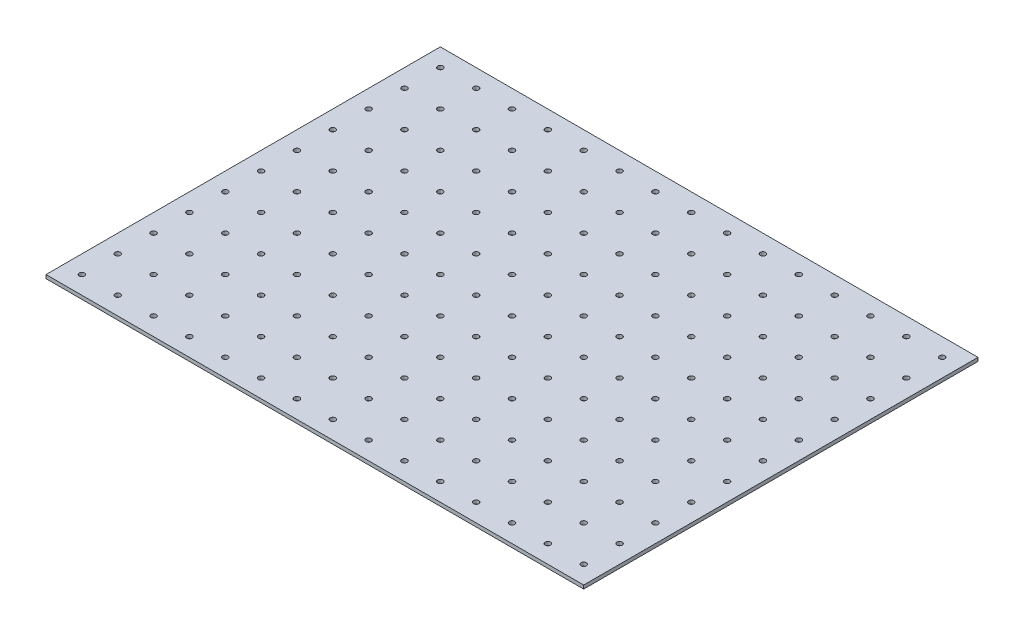
from build123d import *

# Parameters (mm, degrees)
SKETCH1_W           = 300
SKETCH1_H           = 220
BOSS_EXTRUDE1_DEPTH = 1
SKETCH3_R           = 1.5
CUT_EXTRUDE1_DEPTH  = 187.021504133


with BuildPart() as part:
    # Sketch1 → Boss-Extrude1 (new, symmetric)
    with BuildSketch(Plane(origin=(0, 0, 0), x_dir=(1, 0, 0), z_dir=(0, 1, 0))):
        Rectangle(SKETCH1_W, SKETCH1_H)
    extrude(amount=BOSS_EXTRUDE1_DEPTH, both=True)

    # Sketch3 → Cut-Extrude1 (cut, through all)
    with BuildSketch(Plane(origin=(0, 1, 0), x_dir=(1, 0, 0), z_dir=(0, 1, 0))):
        with Locations(Location((-140, 100, 0), (0, 0, 270))):
            Circle(SKETCH3_R)
        with Locations(Location((-120, 100, 0), (0, 0, 270))):
            Circle(SKETCH3_R)
        with Locations(Location((-100, 100, 0), (0, 0, 270))):
            Circle(SKETCH3_R)
        with Locations(Location((-80, 100, 0), (0, 0, 270))):
            Circle(SKETCH3_R)
        with Locations(Location((-60, 100, 0), (0, 0, 270))):
            Circle(SKETCH3_R)
        with Locations(Location((-40, 100, 0), (0, 0, 270))):
            Circle(SKETCH3_R)
        with Locations(Location((-20, 100, 0), (0, 0, 270))):
            Circle(SKETCH3_R)
        with Locations(Location((0, 100, 0), (0, 0, 270))):
            Circle(SKETCH3_R)
        with Locations(Location((20, 100, 0), (0, 0, 270))):
            Circle(SKETCH3_R)
        with Locations(Location((40, 100, 0), (0, 0, 270))):
            Circle(SKETCH3_R)
        with Locations(Location((60, 100, 0), (0, 0, 270))):
            Circle(SKETCH3_R)
        with Locations(Location((80, 100, 0), (0, 0, 270))):
            Circle(SKETCH3_R)
        with Locations(Location((100, 100, 0), (0, 0, 270))):
            Circle(SKETCH3_R)
        with Locations(Location((120, 100, 0), (0, 0, 270))):
            Circle(SKETCH3_R)
        with Locations(Location((140, 100, 0), (0, 0, 270))):
            Circle(SKETCH3_R)
        with Locations(Location((-120, 80, 0), (0, 0, 270))):
            Circle(SKETCH3_R)
        with Locations(Location((-100, 80, 0), (0, 0, 270))):
            Circle(SKETCH3_R)
        with Locations(Location((-80, 80, 0), (0, 0, 270))):
            Circle(SKETCH3_R)
        with Locations(Location((-60, 80, 0), (0, 0, 270))):
            Circle(SKETCH3_R)
        with Locations(Location((-40, 80, 0), (0, 0, 270))):
            Circle(SKETCH3_R)
        with Locations(Location((-20, 80, 0), (0, 0, 270))):
            Circle(SKETCH3_R)
        with Locations(Location((0, 80, 0), (0, 0, 270))):
            Circle(SKETCH3_R)
        with Locations(Location((20, 80, 0), (0, 0, 270))):
            Circle(SKETCH3_R)
        with Locations(Location((40, 80, 0), (0, 0, 270))):
            Circle(SKETCH3_R)
        with Locations(Location((60, 80, 0), (0, 0, 270))):
            Circle(SKETCH3_R)
        with Locations(Location((80, 80, 0), (0, 0, 270))):
            Circle(SKETCH3_R)
        with Locations(Location((100, 80, 0), (0, 0, 270))):
            Circle(SKETCH3_R)
        with Locations(Location((120, 80, 0), (0, 0, 270))):
            Circle(SKETCH3_R)
        with Locations(Location((140, 80, 0), (0, 0, 270))):
            Circle(SKETCH3_R)
        with Locations(Location((-120, 60, 0), (0, 0, 270))):
            Circle(SKETCH3_R)
        with Locations(Location((-100, 60, 0), (0, 0, 270))):
            Circle(SKETCH3_R)
        with Locations(Location((-80, 60, 0), (0, 0, 270))):
            Circle(SKETCH3_R)
        with Locations(Location((-60, 60, 0), (0, 0, 270))):
            Circle(SKETCH3_R)
        with Locations(Location((-40, 60, 0), (0, 0, 270))):
            Circle(SKETCH3_R)
        with Locations(Location((-20, 60, 0), (0, 0, 270))):
            Circle(SKETCH3_R)
        with Locations(Location((0, 60, 0), (0, 0, 270))):
            Circle(SKETCH3_R)
        with Locations(Location((20, 60, 0), (0, 0, 270))):
            Circle(SKETCH3_R)
        with Locations(Location((40, 60, 0), (0, 0, 270))):
            Circle(SKETCH3_R)
        with Locations(Location((60, 60, 0), (0, 0, 270))):
            Circle(SKETCH3_R)
        with Locations(Location((80, 60, 0), (0, 0, 270))):
            Circle(SKETCH3_R)
        with Locations(Location((100, 60, 0), (0, 0, 270))):
            Circle(SKETCH3_R)
        with Locations(Location((120, 60, 0), (0, 0, 270))):
            Circle(SKETCH3_R)
        with Locations(Location((140, 60, 0), (0, 0, 270))):
            Circle(SKETCH3_R)
        with Locations(Location((-120, 40, 0), (0, 0, 270))):
            Circle(SKETCH3_R)
        with Locations(Location((-100, 40, 0), (0, 0, 270))):
            Circle(SKETCH3_R)
        with Locations(Location((-80, 40, 0), (0, 0, 270))):
            Circle(SKETCH3_R)
        with Locations(Location((-60, 40, 0), (0, 0, 270))):
            Circle(SKETCH3_R)
        with Locations(Location((-40, 40, 0), (0, 0, 270))):
            Circle(SKETCH3_R)
        with Locations(Location((-20, 40, 0), (0, 0, 270))):
            Circle(SKETCH3_R)
        with Locations(Location((0, 40, 0), (0, 0, 270))):
            Circle(SKETCH3_R)
        with Locations(Location((20, 40, 0), (0, 0, 270))):
            Circle(SKETCH3_R)
        with Locations(Location((40, 40, 0), (0, 0, 270))):
            Circle(SKETCH3_R)
        with Locations(Location((60, 40, 0), (0, 0, 270))):
            Circle(SKETCH3_R)
        with Locations(Location((80, 40, 0), (0, 0, 270))):
            Circle(SKETCH3_R)
        with Locations(Location((100, 40, 0), (0, 0, 270))):
            Circle(SKETCH3_R)
        with Locations(Location((120, 40, 0), (0, 0, 270))):
            Circle(SKETCH3_R)
        with Locations(Location((140, 40, 0), (0, 0, 270))):
            Circle(SKETCH3_R)
        with Locations(Location((-120, 20, 0), (0, 0, 270))):
            Circle(SKETCH3_R)
        with Locations(Location((-100, 20, 0), (0, 0, 270))):
            Circle(SKETCH3_R)
        with Locations(Location((-80, 20, 0), (0, 0, 270))):
            Circle(SKETCH3_R)
        with Locations(Location((-60, 20, 0), (0, 0, 270))):
            Circle(SKETCH3_R)
        with Locations(Location((-40, 20, 0), (0, 0, 270))):
            Circle(SKETCH3_R)
        with Locations(Location((-20, 20, 0), (0, 0, 270))):
            Circle(SKETCH3_R)
        with Locations(Location((0, 20, 0), (0, 0, 270))):
            Circle(SKETCH3_R)
        with Locations(Location((20, 20, 0), (0, 0, 270))):
            Circle(SKETCH3_R)
        with Locations(Location((40, 20, 0), (0, 0, 270))):
            Circle(SKETCH3_R)
        with Locations(Location((60, 20, 0), (0, 0, 270))):
            Circle(SKETCH3_R)
        with Locations(Location((80, 20, 0), (0, 0, 270))):
            Circle(SKETCH3_R)
        with Locations(Location((100, 20, 0), (0, 0, 270))):
            Circle(SKETCH3_R)
        with Locations(Location((120, 20, 0), (0, 0, 270))):
            Circle(SKETCH3_R)
        with Locations(Location((140, 20, 0), (0, 0, 270))):
            Circle(SKETCH3_R)
        with Locations(Location((-120, 0, 0), (0, 0, 270))):
            Circle(SKETCH3_R)
        with Locations(Location((-100, 0, 0), (0, 0, 270))):
            Circle(SKETCH3_R)
        with Locations(Location((-80, 0, 0), (0, 0, 270))):
            Circle(SKETCH3_R)
        with Locations(Location((-60, 0, 0), (0, 0, 270))):
            Circle(SKETCH3_R)
        with Locations(Location((-40, 0, 0), (0, 0, 270))):
            Circle(SKETCH3_R)
        with Locations(Location((-20, 0, 0), (0, 0, 270))):
            Circle(SKETCH3_R)
        with Locations(Location((0, 0, 0), (0, 0, 270))):
            Circle(SKETCH3_R)
        with Locations(Location((20, 0, 0), (0, 0, 270))):
            Circle(SKETCH3_R)
        with Locations(Location((40, 0, 0), (0, 0, 270))):
            Circle(SKETCH3_R)
        with Locations(Location((60, 0, 0), (0, 0, 270))):
            Circle(SKETCH3_R)
        with Locations(Location((80, 0, 0), (0, 0, 270))):
            Circle(SKETCH3_R)
        with Locations(Location((100, 0, 0), (0, 0, 270))):
            Circle(SKETCH3_R)
        with Locations(Location((120, 0, 0), (0, 0, 270))):
            Circle(SKETCH3_R)
        with Locations(Location((140, 0, 0), (0, 0, 270))):
            Circle(SKETCH3_R)
        with Locations(Location((-120, -20, 0), (0, 0, 270))):
            Circle(SKETCH3_R)
        with Locations(Location((-100, -20, 0), (0, 0, 270))):
            Circle(SKETCH3_R)
        with Locations(Location((-80, -20, 0), (0, 0, 270))):
            Circle(SKETCH3_R)
        with Locations(Location((-60, -20, 0), (0, 0, 270))):
            Circle(SKETCH3_R)
        with Locations(Location((-40, -20, 0), (0, 0, 270))):
            Circle(SKETCH3_R)
        with Locations(Location((-20, -20, 0), (0, 0, 270))):
            Circle(SKETCH3_R)
        with Locations(Location((0, -20, 0), (0, 0, 270))):
            Circle(SKETCH3_R)
        with Locations(Location((20, -20, 0), (0, 0, 270))):
            Circle(SKETCH3_R)
        with Locations(Location((40, -20, 0), (0, 0, 270))):
            Circle(SKETCH3_R)
        with Locations(Location((60, -20, 0), (0, 0, 270))):
            Circle(SKETCH3_R)
        with Locations(Location((80, -20, 0), (0, 0, 270))):
            Circle(SKETCH3_R)
        with Locations(Location((100, -20, 0), (0, 0, 270))):
            Circle(SKETCH3_R)
        with Locations(Location((120, -20, 0), (0, 0, 270))):
            Circle(SKETCH3_R)
        with Locations(Location((140, -20, 0), (0, 0, 270))):
            Circle(SKETCH3_R)
        with Locations(Location((-120, -40, 0), (0, 0, 270))):
            Circle(SKETCH3_R)
        with Locations(Location((-100, -40, 0), (0, 0, 270))):
            Circle(SKETCH3_R)
        with Locations(Location((-80, -40, 0), (0, 0, 270))):
            Circle(SKETCH3_R)
        with Locations(Location((-60, -40, 0), (0, 0, 270))):
            Circle(SKETCH3_R)
        with Locations(Location((-40, -40, 0), (0, 0, 270))):
            Circle(SKETCH3_R)
        with Locations(Location((-20, -40, 0), (0, 0, 270))):
            Circle(SKETCH3_R)
        with Locations(Location((0, -40, 0), (0, 0, 270))):
            Circle(SKETCH3_R)
        with Locations(Location((20, -40, 0), (0, 0, 270))):
            Circle(SKETCH3_R)
        with Locations(Location((40, -40, 0), (0, 0, 270))):
            Circle(SKETCH3_R)
        with Locations(Location((60, -40, 0), (0, 0, 270))):
            Circle(SKETCH3_R)
        with Locations(Location((80, -40, 0), (0, 0, 270))):
            Circle(SKETCH3_R)
        with Locations(Location((100, -40, 0), (0, 0, 270))):
            Circle(SKETCH3_R)
        with Locations(Location((120, -40, 0), (0, 0, 270))):
            Circle(SKETCH3_R)
        with Locations(Location((140, -40, 0), (0, 0, 270))):
            Circle(SKETCH3_R)
        with Locations(Location((-120, -60, 0), (0, 0, 270))):
            Circle(SKETCH3_R)
        with Locations(Location((-100, -60, 0), (0, 0, 270))):
            Circle(SKETCH3_R)
        with Locations(Location((-80, -60, 0), (0, 0, 270))):
            Circle(SKETCH3_R)
        with Locations(Location((-60, -60, 0), (0, 0, 270))):
            Circle(SKETCH3_R)
        with Locations(Location((-40, -60, 0), (0, 0, 270))):
            Circle(SKETCH3_R)
        with Locations(Location((-20, -60, 0), (0, 0, 270))):
            Circle(SKETCH3_R)
        with Locations(Location((0, -60, 0), (0, 0, 270))):
            Circle(SKETCH3_R)
        with Locations(Location((20, -60, 0), (0, 0, 270))):
            Circle(SKETCH3_R)
        with Locations(Location((40, -60, 0), (0, 0, 270))):
            Circle(SKETCH3_R)
        with Locations(Location((60, -60, 0), (0, 0, 270))):
            Circle(SKETCH3_R)
        with Locations(Location((80, -60, 0), (0, 0, 270))):
            Circle(SKETCH3_R)
        with Locations(Location((100, -60, 0), (0, 0, 270))):
            Circle(SKETCH3_R)
        with Locations(Location((120, -60, 0), (0, 0, 270))):
            Circle(SKETCH3_R)
        with Locations(Location((140, -60, 0), (0, 0, 270))):
            Circle(SKETCH3_R)
        with Locations(Location((-120, -80, 0), (0, 0, 270))):
            Circle(SKETCH3_R)
        with Locations(Location((-100, -80, 0), (0, 0, 270))):
            Circle(SKETCH3_R)
        with Locations(Location((-80, -80, 0), (0, 0, 270))):
            Circle(SKETCH3_R)
        with Locations(Location((-60, -80, 0), (0, 0, 270))):
            Circle(SKETCH3_R)
        with Locations(Location((-40, -80, 0), (0, 0, 270))):
            Circle(SKETCH3_R)
        with Locations(Location((-20, -80, 0), (0, 0, 270))):
            Circle(SKETCH3_R)
        with Locations(Location((0, -80, 0), (0, 0, 270))):
            Circle(SKETCH3_R)
        with Locations(Location((20, -80, 0), (0, 0, 270))):
            Circle(SKETCH3_R)
        with Locations(Location((40, -80, 0), (0, 0, 270))):
            Circle(SKETCH3_R)
        with Locations(Location((60, -80, 0), (0, 0, 270))):
            Circle(SKETCH3_R)
        with Locations(Location((80, -80, 0), (0, 0, 270))):
            Circle(SKETCH3_R)
        with Locations(Location((100, -80, 0), (0, 0, 270))):
            Circle(SKETCH3_R)
        with Locations(Location((120, -80, 0), (0, 0, 270))):
            Circle(SKETCH3_R)
        with Locations(Location((140, -80, 0), (0, 0, 270))):
            Circle(SKETCH3_R)
        with Locations(Location((-120, -100, 0), (0, 0, 270))):
            Circle(SKETCH3_R)
        with Locations(Location((-100, -100, 0), (0, 0, 270))):
            Circle(SKETCH3_R)
        with Locations(Location((-80, -100, 0), (0, 0, 270))):
            Circle(SKETCH3_R)
        with Locations(Location((-60, -100, 0), (0, 0, 270))):
            Circle(SKETCH3_R)
        with Locations(Location((-40, -100, 0), (0, 0, 270))):
            Circle(SKETCH3_R)
        with Locations(Location((-20, -100, 0), (0, 0, 270))):
            Circle(SKETCH3_R)
        with Locations(Location((0, -100, 0), (0, 0, 270))):
            Circle(SKETCH3_R)
        with Locations(Location((20, -100, 0), (0, 0, 270))):
            Circle(SKETCH3_R)
        with Locations(Location((40, -100, 0), (0, 0, 270))):
            Circle(SKETCH3_R)
        with Locations(Location((60, -100, 0), (0, 0, 270))):
            Circle(SKETCH3_R)
        with Locations(Location((80, -100, 0), (0, 0, 270))):
            Circle(SKETCH3_R)
        with Locations(Location((100, -100, 0), (0, 0, 270))):
            Circle(SKETCH3_R)
        with Locations(Location((120, -100, 0), (0, 0, 270))):
            Circle(SKETCH3_R)
        with Locations(Location((140, -100, 0), (0, 0, 270))):
            Circle(SKETCH3_R)
        with Locations(Location((-140, 80, 0), (0, 0, 270))):
            Circle(SKETCH3_R)
        with Locations(Location((-140, 60, 0), (0, 0, 270))):
            Circle(SKETCH3_R)
        with Locations(Location((-140, 40, 0), (0, 0, 270))):
            Circle(SKETCH3_R)
        with Locations(Location((-140, 20, 0), (0, 0, 270))):
            Circle(SKETCH3_R)
        with Locations(Location((-140, 0, 0), (0, 0, 270))):
            Circle(SKETCH3_R)
        with Locations(Location((-140, -20, 0), (0, 0, 270))):
            Circle(SKETCH3_R)
        with Locations(Location((-140, -40, 0), (0, 0, 270))):
            Circle(SKETCH3_R)
        with Locations(Location((-140, -60, 0), (0, 0, 270))):
            Circle(SKETCH3_R)
        with Locations(Location((-140, -80, 0), (0, 0, 270))):
            Circle(SKETCH3_R)
        with Locations(Location((-140, -100, 0), (0, 0, 270))):
            Circle(SKETCH3_R)
    extrude(amount=-CUT_EXTRUDE1_DEPTH, mode=Mode.SUBTRACT)


solid = part.part
